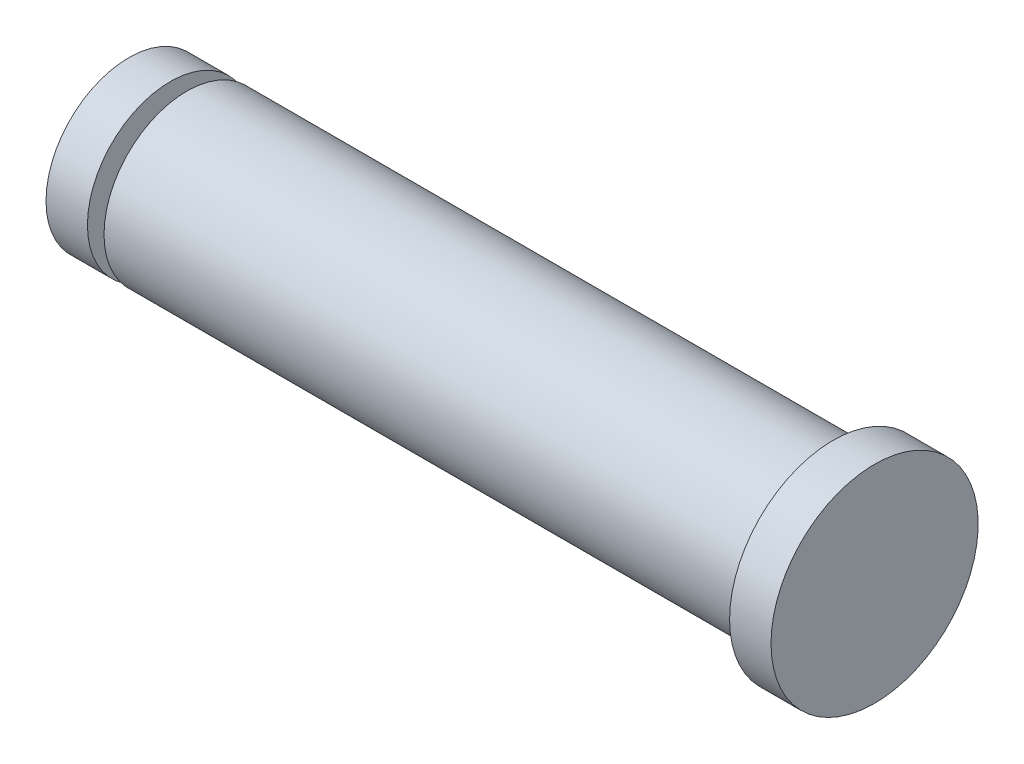
from build123d import *


with BuildPart() as part:
    # 草图1 → 旋转1 (revolve)
    with BuildSketch(Plane.XY, mode=Mode.PRIVATE) as revolve_1_sk:
        Polygon((0, 0), (270, 0), (270, 37.5), (255, 37.5), (255, 30), (21, 30), (21, 20), (15, 20), (15, 30), (0, 30), align=None)
    revolve(revolve_1_sk.sketch.rotate(Axis((0, 0, 0), (1, 0, 0)), 90), axis=Axis((0, 0, 0), (1, 0, 0)))


solid = part.part
